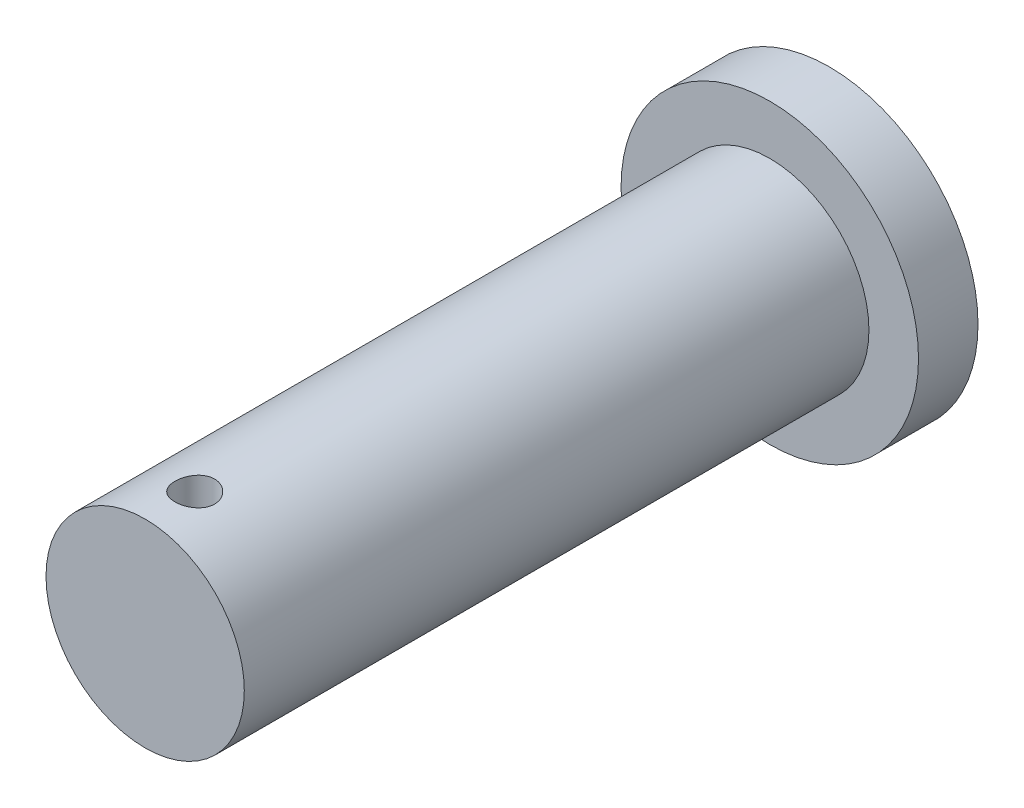
from build123d import *

# Parameters (mm, degrees)
SKETCH1_R           = 5
BOSS_EXTRUDE1_DEPTH = 31.5
SKETCH2_R           = 1
CUT_EXTRUDE1_DEPTH  = 5
SKETCH3_R           = 7.5
BOSS_EXTRUDE2_DEPTH = 3


with BuildPart() as part:
    # Sketch1 → Boss-Extrude1 (new body)
    with BuildSketch(Plane.XY):
        Circle(SKETCH1_R)
    extrude(amount=BOSS_EXTRUDE1_DEPTH)

    # Sketch2 → Cut-Extrude1 (cut, symmetric)
    with BuildSketch(Plane(origin=(0, 0, 0), x_dir=(1, 0, 0), z_dir=(0, 1, 0))):
        with Locations(Location((0, -29, 0), (0, 0, 270))):
            Circle(SKETCH2_R)
    extrude(amount=CUT_EXTRUDE1_DEPTH, both=True, mode=Mode.SUBTRACT)

    # Sketch3 → Boss-Extrude2 (add)
    with BuildSketch(Plane(origin=(0, 0, 0), x_dir=(-1, 0, 0), z_dir=(0, 0, -1))):
        Circle(SKETCH3_R)
    extrude(amount=BOSS_EXTRUDE2_DEPTH)


solid = part.part
